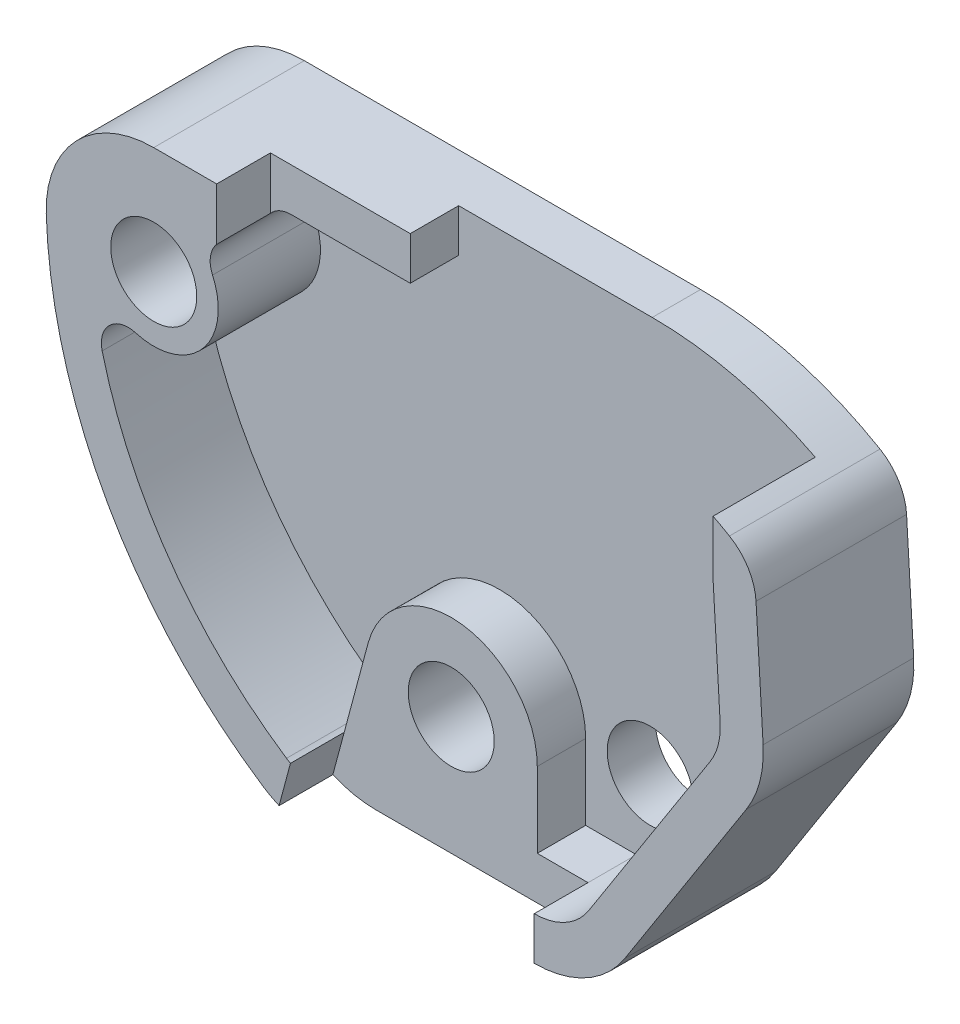
from build123d import *

# Parameters (mm, degrees)
RESSALTO_EXTRUS_O1_DEPTH = 4.5
RESSALTO_EXTRUS_O2_DEPTH = 9.5
ESBO_O3_R                = 4
CORTE_EXTRUS_O1_DEPTH    = 83.662767221
ESBO_O4_R                = 4
CORTE_EXTRUS_O2_DEPTH    = 9
CORTE_EXTRUS_O3_START    = -5
CORTE_EXTRUS_O3_DEPTH    = 5


with BuildPart() as part:
    # Esboço1 → Ressalto-extrusão1 (new body)
    with BuildSketch(Plane.XY):
        with BuildLine():
            Line((9.147918148, 0), (46, 0))
            ThreePointArc((46, 0), (54.638987457, -1.147854001), (62.678501082, -4.511764491))
            ThreePointArc((62.678501082, -4.511764491), (64.418912726, -6.213954583), (65.149192683, -8.536275617))
            Line((65.149192683, -8.536275617), (65.809281576, -19.757786799))
            ThreePointArc((65.809281576, -19.757786799), (65.502467458, -22.870157731), (64.249251851, -25.735543982))
            Line((64.249251851, -25.735543982), (52.950056343, -43.390536964))
            ThreePointArc((52.950056343, -43.390536964), (49.328104274, -46.772267941), (44.527342336, -48))
            Line((44.527342336, -48), (24.806503657, -48))
            ThreePointArc((24.806503657, -48), (21.92395029, -47.575535812), (19.286105058, -46.338177218))
            ThreePointArc((19.286105058, -46.338177218), (4.852329177, -30.780660617), (-0.846362024, -10.338177218))
            ThreePointArc((-0.846362024, -10.338177218), (1.958280738, -3.049524195), (9.147918148, 0))
        make_face()
    extrude(amount=RESSALTO_EXTRUS_O1_DEPTH)

    # Esboço2 → Ressalto-extrusão2 (add)
    with BuildSketch(Plane.XY.offset(4.5)):
        with BuildLine():
            Line((16.893884841, -4), (28, -4))
            Line((28, -4), (28, 0))
            Line((28, 0), (9.147918148, 0))
            ThreePointArc((9.147918148, 0), (1.958280738, -3.049524195), (-0.846362024, -10.338177218))
            ThreePointArc((-0.846362024, -10.338177218), (4.852329177, -30.780660617), (19.286105058, -46.338177218))
            ThreePointArc((19.286105058, -46.338177218), (21.92395029, -47.575535812), (24.806503657, -48))
            Line((24.806503657, -48), (44.527342336, -48))
            ThreePointArc((44.527342336, -48), (49.328104274, -46.772267941), (52.950056343, -43.390536964))
            Line((52.950056343, -43.390536964), (64.249251851, -25.735543982))
            ThreePointArc((64.249251851, -25.735543982), (65.502467458, -22.870157731), (65.809281576, -19.757786799))
            Line((65.809281576, -19.757786799), (65.149192683, -8.536275617))
            ThreePointArc((65.149192683, -8.536275617), (64.418912726, -6.213954583), (62.678501082, -4.511764491))
            ThreePointArc((62.678501082, -4.511764491), (61.922784483, -4.083818187), (61.156095191, -3.675856002))
            Line((61.156095191, -3.675856002), (61.156095191, -8.771163705))
            Line((61.156095191, -8.771163705), (61.816184084, -19.992674886))
            ThreePointArc((61.816184084, -19.992674886), (61.632095612, -21.860097446), (60.880166249, -23.579329197))
            Line((60.880166249, -23.579329197), (49.58097074, -41.234322179))
            ThreePointArc((49.58097074, -41.234322179), (47.407799499, -43.263360764), (44.527342336, -44))
            Line((44.527342336, -44), (39.809281576, -44))
            Line((39.809281576, -44), (39.809281576, -37))
            ThreePointArc((39.809281576, -37), (32.853491114, -29.068441109), (24.081874966, -34.929447639))
            Line((24.081874966, -34.929447639), (21.858818506, -43.226007295))
            ThreePointArc((21.858818506, -43.226007295), (21.674554328, -43.117703919), (21.494264498, -43.002906331))
            ThreePointArc((21.494264498, -43.002906331), (10.654614821, -32.492090136), (4.354572925, -18.770401671))
            ThreePointArc((4.354572925, -18.770401671), (5.045111797, -16.363187723), (7.476288198, -15.762434669))
            ThreePointArc((7.476288198, -15.762434669), (13.680939401, -13.930867375), (14.615659343, -7.529411765))
            ThreePointArc((14.615659343, -7.529411765), (14.793464715, -5.144184639), (16.893884841, -4))
        make_face()
    extrude(amount=RESSALTO_EXTRUS_O2_DEPTH)

    # Esboço3 → Corte-extrusão1 (cut, through all)
    with BuildSketch(Plane.XY.offset(14)):
        with Locations((31.809281576, -37)):
            Circle(ESBO_O3_R)
        with Locations((45.809281576, -37)):
            Circle(ESBO_O3_R)
    extrude(amount=-CORTE_EXTRUS_O1_DEPTH, mode=Mode.SUBTRACT)

    # Esboço4 → Corte-extrusão2 (cut)
    with BuildSketch(Plane.XY.offset(14)):
        with Locations((9.147918148, -10)):
            Circle(ESBO_O4_R)
    extrude(amount=-CORTE_EXTRUS_O2_DEPTH, mode=Mode.SUBTRACT)

    # Esboço5 → Corte-extrusão3 (cut)
    with BuildSketch(Plane.XY.offset(14).offset(CORTE_EXTRUS_O3_START)):
        with BuildLine():
            Line((28, -4), (28, 0))
            Line((28, 0), (15, 0))
            Line((15, 0), (15, -4.868068564))
            ThreePointArc((15, -4.868068564), (15.852210369, -4.22735522), (16.893884841, -4))
            Line((16.893884841, -4), (28, -4))
        make_face()
        with BuildLine():
            Line((39.809281576, -44), (44.527342336, -44))
            Line((44.527342336, -44), (44.527342336, -48))
            Line((44.527342336, -48), (24.806503657, -48))
            ThreePointArc((24.806503657, -48), (22.761888864, -47.788746107), (20.803660638, -47.16391007))
            Line((20.803660638, -47.16391007), (21.858818506, -43.226007295))
            Line((21.858818506, -43.226007295), (24.081874966, -34.929447639))
            ThreePointArc((24.081874966, -34.929447639), (32.853491114, -29.068441109), (39.809281576, -37))
            Line((39.809281576, -37), (39.809281576, -44))
        make_face()
    extrude(amount=CORTE_EXTRUS_O3_DEPTH, mode=Mode.SUBTRACT)


solid = part.part
